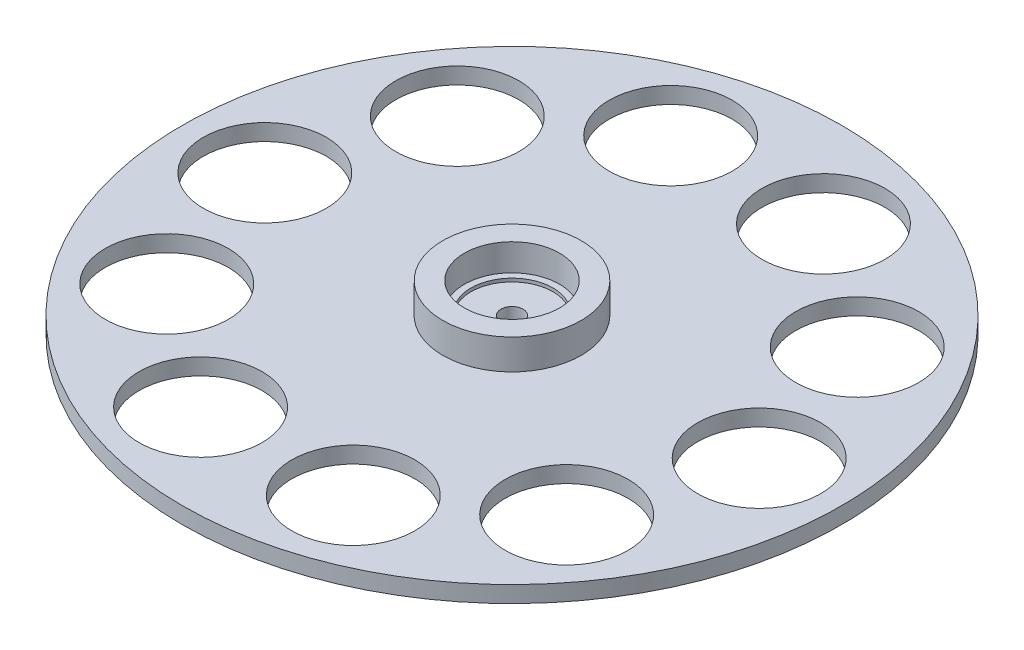
from build123d import *

# Parameters (mm, degrees)
SKETCH1_R           = 76.2
SKETCH1_R_2         = 14.224
BOSS_EXTRUDE1_DEPTH = 3.81
SKETCH4_R           = 16
SKETCH4_R_2         = 11
BOSS_EXTRUDE5_DEPTH = 7
SKETCH5_R           = 11
SKETCH5_R_2         = 9.5
BOSS_EXTRUDE6_DEPTH = 0.762
SKETCH6_R           = 2.55
CUT_EXTRUDE1_DEPTH  = 109.303906208


with BuildPart() as part:
    # Sketch1 → Boss-Extrude1 (new body)
    with BuildSketch(Plane(origin=(0, 0, 0), x_dir=(1, 0, 0), z_dir=(0, 1, 0))):
        with Locations(Location((0, 0, 0), (0, 0, 90))):
            Circle(SKETCH1_R)
        with Locations(Location((-57.15, 0, 0), (0, 0, 90))):
            Circle(SKETCH1_R_2, mode=Mode.SUBTRACT)
        with Locations(Location((-46.235321229, 33.591927169, 0), (0, 0, 90))):
            Circle(SKETCH1_R_2, mode=Mode.SUBTRACT)
        with Locations(Location((-17.660321229, 54.352879906, 0), (0, 0, 90))):
            Circle(SKETCH1_R_2, mode=Mode.SUBTRACT)
        with Locations(Location((17.660321229, 54.352879906, 0), (0, 0, 90))):
            Circle(SKETCH1_R_2, mode=Mode.SUBTRACT)
        with Locations(Location((46.235321229, 33.591927169, 0), (0, 0, 90))):
            Circle(SKETCH1_R_2, mode=Mode.SUBTRACT)
        with Locations(Location((57.15, 0, 0), (0, 0, 90))):
            Circle(SKETCH1_R_2, mode=Mode.SUBTRACT)
        with Locations(Location((46.235321229, -33.591927169, 0), (0, 0, 90))):
            Circle(SKETCH1_R_2, mode=Mode.SUBTRACT)
        with Locations(Location((17.660321229, -54.352879906, 0), (0, 0, 90))):
            Circle(SKETCH1_R_2, mode=Mode.SUBTRACT)
        with Locations(Location((-17.660321229, -54.352879906, 0), (0, 0, 90))):
            Circle(SKETCH1_R_2, mode=Mode.SUBTRACT)
        with Locations(Location((-46.235321229, -33.591927169, 0), (0, 0, 90))):
            Circle(SKETCH1_R_2, mode=Mode.SUBTRACT)
    extrude(amount=BOSS_EXTRUDE1_DEPTH)

    # Sketch4 → Boss-Extrude5 (add)
    with BuildSketch(Plane(origin=(0, 3.81, 0), x_dir=(1, 0, 0), z_dir=(0, 1, 0))):
        with Locations(Location((0, 0, 0), (0, 0, 270))):
            Circle(SKETCH4_R)
        with Locations(Location((0, 0, 0), (0, 0, 270))):
            Circle(SKETCH4_R_2, mode=Mode.SUBTRACT)
    extrude(amount=BOSS_EXTRUDE5_DEPTH)

    # Sketch5 → Boss-Extrude6 (add)
    with BuildSketch(Plane(origin=(0, 3.81, 0), x_dir=(1, 0, 0), z_dir=(0, 1, 0))):
        with Locations(Location((0, 0, 0), (0, 0, 270))):
            Circle(SKETCH5_R)
        with Locations(Location((0, 0, 0), (0, 0, 90))):
            Circle(SKETCH5_R_2, mode=Mode.SUBTRACT)
    extrude(amount=BOSS_EXTRUDE6_DEPTH)

    # Sketch6 → Cut-Extrude1 (cut, through all)
    with BuildSketch(Plane.XZ):
        with Locations(Location((0, 0, 0), (0, 0, 270))):
            Circle(SKETCH6_R)
    extrude(amount=-CUT_EXTRUDE1_DEPTH, mode=Mode.SUBTRACT)


solid = part.part
